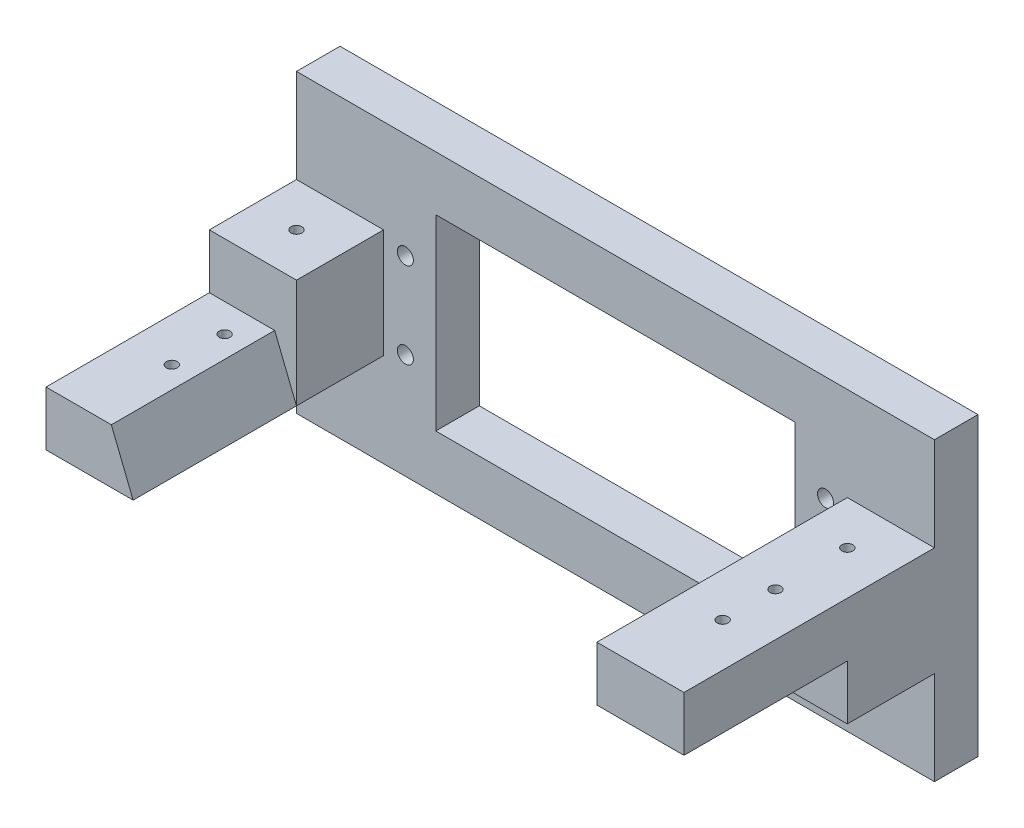
from build123d import *

# Parameters (mm, degrees)
SKETCH1_W               = 54.61
SKETCH1_H               = 47.244
SKETCH1_W_2             = 41.91
SKETCH1_H_2             = 21.844
BOSS_EXTRUDE1_DEPTH     = 5.08
SKETCH2_R               = 0.93599
CUT_EXTRUDE1_DEPTH      = 73.388217522
SKETCH10_W              = 14.41958
SKETCH10_H              = 19.49958
SKETCH10_R              = 0.635
BOSS_EXTRUDE4_DEPTH     = 5.08
SKETCH11_R              = 0.635
SKETCH11_W              = 3.302
SKETCH11_H              = 76.2
BOSS_EXTRUDE5_DEPTH     = 5.08
SKETCH12_W              = 60.452
SKETCH12_H              = 6.35
SKETCH12_W_2            = 59.182
CUT_EXTRUDE2_DEPTH      = 95.448366629
SKETCH13_W              = 7.0195552
SKETCH13_H              = 78.993394517
BOSS_EXTRUDE6_DEPTH     = 4.826
FILLET1_R               = 2.54
CUT_EXTRUDE3_DEPTH      = 95.448366629
SKETCH15_W              = 9.078627065
SKETCH15_H              = 34.544
BOSS_EXTRUDE7_DEPTH     = 5.08
SKETCH16_W              = 10.16
SKETCH16_H              = 12.7
BOSS_EXTRUDE8_DEPTH     = 10.16
SKETCH17_R              = 0.635
CUT_EXTRUDE4_DEPTH      = 71.364025147
SKETCH18_W              = 10.16
SKETCH18_H              = 6.35
BOSS_EXTRUDE9_DEPTH     = 12.76096
CUT_EXTRUDE5_DEPTH      = 73.410049688
CUT_EXTRUDE5_DEPTH_BACK = 73.410049688
SKETCH19_R              = 0.635
SKETCH20_W              = 10.16
SKETCH20_H              = 6.35
BOSS_EXTRUDE10_DEPTH    = 6.28904
CUT_EXTRUDE7_DEPTH      = 19.05


with BuildPart() as part:
    # Sketch1 → Boss-Extrude1 (new body)
    with BuildSketch(Plane.XY):
        with Locations((27.305, 23.622)):
            Rectangle(SKETCH1_W, SKETCH1_H)
        with Locations((27.305, 23.622)):
            Rectangle(SKETCH1_W_2, SKETCH1_H_2, mode=Mode.SUBTRACT)
    extrude(amount=BOSS_EXTRUDE1_DEPTH)

    # Sketch2 → Cut-Extrude1 (cut, through all)
    with BuildSketch(Plane.XY.offset(5.08)):
        with Locations((2.80543, 28.62199)):
            Circle(SKETCH2_R)
        with Locations((2.80543, 18.62201)):
            Circle(SKETCH2_R)
        with Locations((51.80457, 28.62199)):
            Circle(SKETCH2_R)
        with Locations((51.80457, 18.62201)):
            Circle(SKETCH2_R)
    extrude(amount=-CUT_EXTRUDE1_DEPTH, mode=Mode.SUBTRACT)

    # Sketch10 → Boss-Extrude4 (add)
    with BuildSketch(Plane.XY.offset(5.08)):
        with Locations((61.81979, 23.622)):
            Rectangle(SKETCH10_W, SKETCH10_H)
        with Locations((64.35979, 21.49221)):
            Circle(SKETCH10_R, mode=Mode.SUBTRACT)
        with Locations((64.35979, 25.75179)):
            Circle(SKETCH10_R, mode=Mode.SUBTRACT)
    extrude(amount=-BOSS_EXTRUDE4_DEPTH)

    # Sketch11 → Boss-Extrude5 (add)
    with BuildSketch(Plane.XY.offset(5.08)):
        Polygon((0, 47.244), (-5.842, 47.244), (-5.842, 64.262), (-15.748, 64.262), (-15.748, -17.018), (-4.572, -17.018), (-4.572, 0), (0, 0), align=None)
        with Locations(Location((-4.572, 21.49221, 0), (0, 0, 180))):
            Circle(SKETCH11_R, mode=Mode.SUBTRACT)
        with Locations(Location((-4.572, 25.75179, 0), (0, 0, 180))):
            Circle(SKETCH11_R, mode=Mode.SUBTRACT)
        with Locations((-10.795, 23.622)):
            Rectangle(SKETCH11_W, SKETCH11_H, mode=Mode.SUBTRACT)
    extrude(amount=-BOSS_EXTRUDE5_DEPTH)

    # Sketch12 → Cut-Extrude2 (cut, through all)
    with BuildSketch(Plane.XY.offset(5.08)):
        with Locations((24.384, 44.069)):
            Rectangle(SKETCH12_W, SKETCH12_H)
        with Locations((25.019, 3.175)):
            Rectangle(SKETCH12_W_2, SKETCH12_H)
    extrude(amount=-CUT_EXTRUDE2_DEPTH, mode=Mode.SUBTRACT)

    # Sketch13 → Boss-Extrude6 (add)
    with BuildSketch(Plane(origin=(0, 0, 0), x_dir=(-1, 0, 0), z_dir=(0, 0, -1))):
        with Locations((10.665198327, 23.388014827)):
            Rectangle(SKETCH13_W, SKETCH13_H)
    extrude(amount=-BOSS_EXTRUDE6_DEPTH)

    # Fillet1
    fillet1_edges = [part.edges().sort_by_distance(p)[0] for p in [
        (69.02958, 13.87221, 2.54),
        (54.61, 13.87221, 2.54),
        (54.61, 6.35, 2.54),
        (-4.572, 6.35, 2.54),
        (-4.572, -17.018, 2.54),
        (-15.748, -17.018, 2.54),
        (-15.748, 64.262, 2.54),
        (-5.842, 64.262, 2.54),
        (-5.842, 40.894, 2.54),
        (54.61, 40.894, 2.54),
        (54.61, 33.37179, 2.54),
        (69.02958, 33.37179, 2.54),
    ]]
    fillet(fillet1_edges, radius=FILLET1_R)

    # Sketch14 → Cut-Extrude3 (cut, through all)
    with BuildSketch(Plane.XY.offset(5.08)):
        Polygon((2.80543, 40.894), (-0.815942935, 40.894), (-0.815942935, 6.35), (2.80543, 6.35), (2.80543, -19.941776761), (-23.515321153, -19.941776761), (-23.515321153, 65.826532556), (2.80543, 65.826532556), align=None)
        Polygon((51.80457, 40.896870143), (51.80457, 65.826532556), (74.486186006, 65.826532556), (74.486186006, -19.941776761), (51.80457, -19.941776761), (52.07, 6.35), (54.61, 8.89), (54.61, 38.354), align=None)
    extrude(amount=-CUT_EXTRUDE3_DEPTH, mode=Mode.SUBTRACT)

    # Sketch15 → Boss-Extrude7 (add)
    with BuildSketch(Plane.XY.offset(5.08)):
        with Locations((-5.355256468, 23.622)):
            Rectangle(SKETCH15_W, SKETCH15_H)
        Polygon((51.807736495, 40.894), (54.61, 38.354), (54.61, 8.89), (52.07, 6.35), (64.50457, 6.35), (64.50457, 40.894), align=None)
    extrude(amount=-BOSS_EXTRUDE7_DEPTH)

    # Sketch16 → Boss-Extrude8 (add)
    with BuildSketch(Plane.XY.offset(5.08)):
        with Locations((-4.81457, 23.622)):
            Rectangle(SKETCH16_W, SKETCH16_H)
        with Locations((59.42457, 23.622)):
            Rectangle(SKETCH16_W, SKETCH16_H)
    extrude(amount=BOSS_EXTRUDE8_DEPTH)

    # Sketch17 → Cut-Extrude4 (cut, through all)
    with BuildSketch(Plane(origin=(0, 29.972, 0), x_dir=(1, 0, 0), z_dir=(0, 1, 0))):
        with Locations(Location((-4.81457, -10.16, 0), (0, 0, 180))):
            Circle(SKETCH17_R)
        with Locations(Location((59.42457, -10.16, 0), (0, 0, 180))):
            Circle(SKETCH17_R)
    extrude(amount=-CUT_EXTRUDE4_DEPTH, mode=Mode.SUBTRACT)

    # Sketch18 → Boss-Extrude9 (add)
    with BuildSketch(Plane.XY.offset(15.24)):
        with Locations((-4.81457, 20.447)):
            Rectangle(SKETCH18_W, SKETCH18_H)
        with Locations((59.42457, 26.797)):
            Rectangle(SKETCH18_W, SKETCH18_H)
    extrude(amount=BOSS_EXTRUDE9_DEPTH)

    # Sketch19 → Cut-Extrude5 (cut, two sides: drawn at the far end of the back side and taken through both)
    with BuildSketch(Plane(origin=(0, 23.622, 0), x_dir=(1, 0, 0), z_dir=(0, 1, 0)).offset(-CUT_EXTRUDE5_DEPTH_BACK)):
        with Locations(Location((-4.81457, -18.542, 0), (0, 0, 270))):
            Circle(SKETCH19_R)
        with Locations(Location((-4.81457, -24.69896, 0), (0, 0, 270))):
            Circle(SKETCH19_R)
        with Locations(Location((59.42457, -18.542, 0), (0, 0, 270))):
            Circle(SKETCH19_R)
        with Locations(Location((59.42457, -24.69896, 0), (0, 0, 270))):
            Circle(SKETCH19_R)
    extrude(amount=CUT_EXTRUDE5_DEPTH + CUT_EXTRUDE5_DEPTH_BACK, mode=Mode.SUBTRACT)

    # Sketch20 → Boss-Extrude10 (add)
    with BuildSketch(Plane.XY.offset(28.00096)):
        with Locations((-4.81457, 20.447)):
            Rectangle(SKETCH20_W, SKETCH20_H)
        with Locations((59.42457, 26.797)):
            Rectangle(SKETCH20_W, SKETCH20_H)
    extrude(amount=BOSS_EXTRUDE10_DEPTH)

    # Sketch22 → Cut-Extrude7 (cut)
    with BuildSketch(Plane.XY.offset(34.29)):
        Polygon((0.26543, 17.272), (-2.27457, 23.622), (0.26543, 23.622), align=None)
    extrude(amount=-CUT_EXTRUDE7_DEPTH, mode=Mode.SUBTRACT)


solid = part.part
